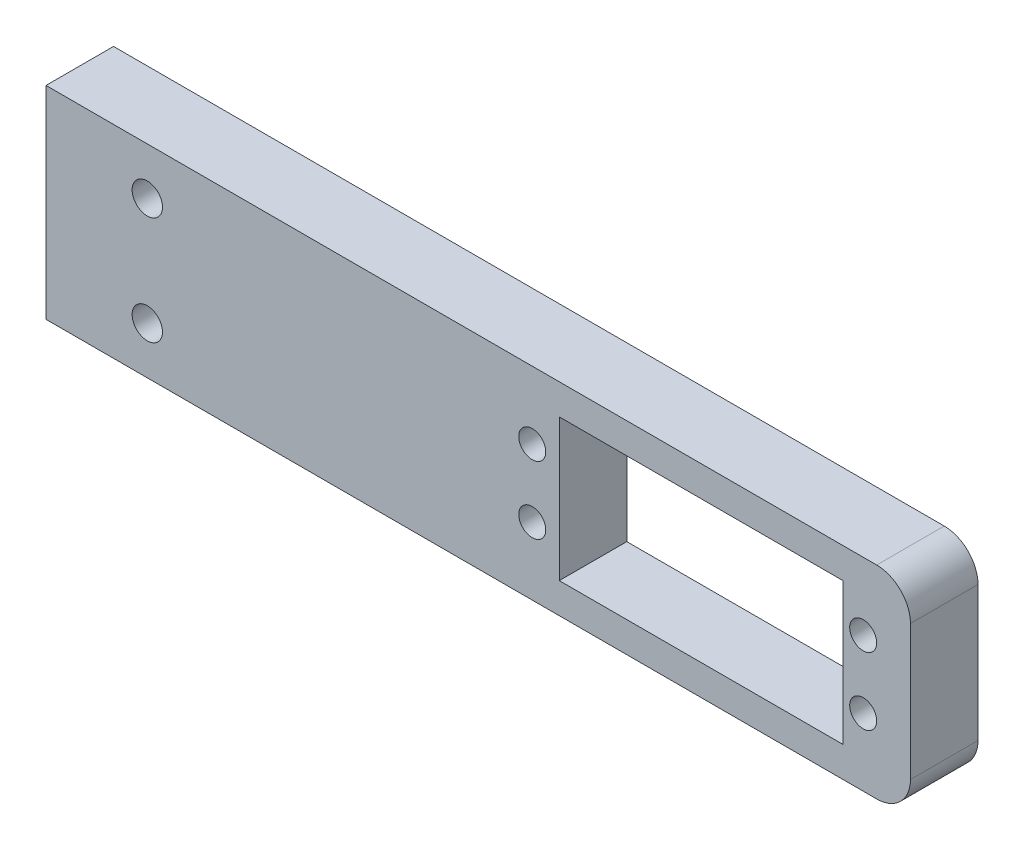
from build123d import *

# Parameters (mm, degrees)
ESQUISSE1_W             = 128
ESQUISSE1_H             = 30
BOSS_EXTRU_1_DEPTH      = 10
ESQUISSE2_R             = 2
ESQUISSE2_W             = 42
ESQUISSE2_H             = 21
ENL_V_MAT_EXTRU_1_DEPTH = 10
CONG_1_R                = 5
ESQUISSE4_R             = 2.25
ENL_V_MAT_EXTRU_2_DEPTH = 10


with BuildPart() as part:
    # Esquisse1 → Boss.-Extru.1 (new body)
    with BuildSketch(Plane.XY):
        with Locations((64, 15)):
            Rectangle(ESQUISSE1_W, ESQUISSE1_H)
    extrude(amount=BOSS_EXTRU_1_DEPTH)

    # Esquisse2 → Enlèv. mat.-Extru.1 (cut)
    with BuildSketch(Plane(origin=(0, 0, 0), x_dir=(-1, 0, 0), z_dir=(0, 0, -1))):
        with Locations((-121, 10)):
            Circle(ESQUISSE2_R)
        with Locations((-121, 20)):
            Circle(ESQUISSE2_R)
        with Locations((-72, 10)):
            Circle(ESQUISSE2_R)
        with Locations((-72, 20)):
            Circle(ESQUISSE2_R)
        with Locations((-97, 15)):
            Rectangle(ESQUISSE2_W, ESQUISSE2_H)
    extrude(amount=-ENL_V_MAT_EXTRU_1_DEPTH, mode=Mode.SUBTRACT)

    # Congé1
    cong_1_edges = [part.edges().sort_by_distance(p)[0] for p in [
        (128, 30, 5),
        (128, 0, 5),
    ]]
    fillet(cong_1_edges, radius=CONG_1_R)

    # Esquisse4 → Enlèv. mat.-Extru.2 (cut)
    with BuildSketch(Plane.XY.offset(10)):
        with Locations((15, 23)):
            Circle(ESQUISSE4_R)
        with Locations((15, 7)):
            Circle(ESQUISSE4_R)
    extrude(amount=-ENL_V_MAT_EXTRU_2_DEPTH, mode=Mode.SUBTRACT)


solid = part.part
